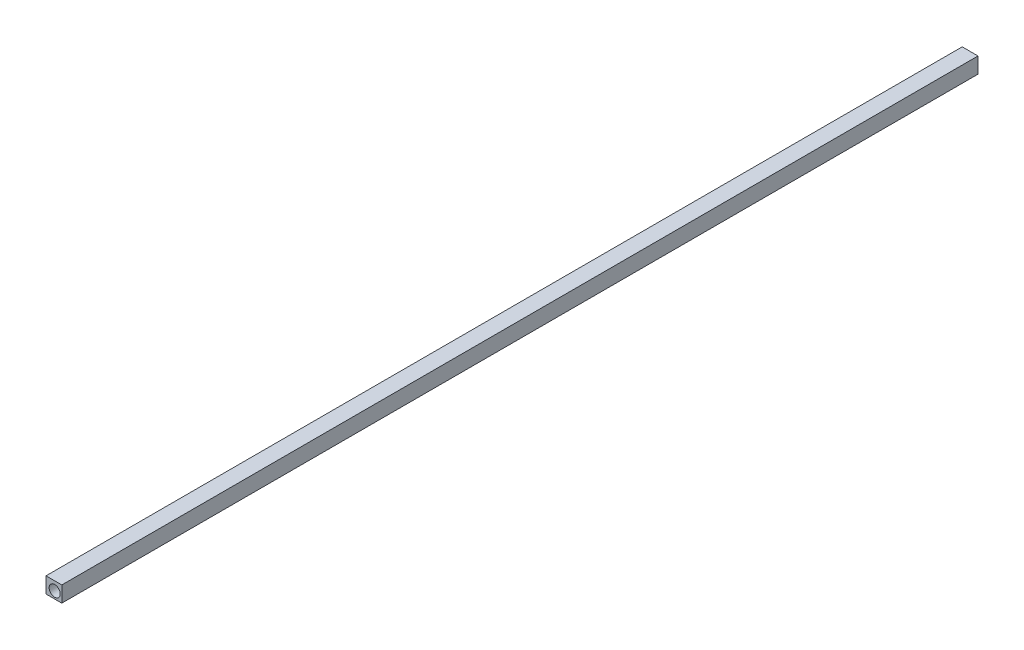
from build123d import *

# Parameters (mm, degrees)
SKETCH_1_W      = 10
SKETCH_1_H      = 10
SKETCH_1_R      = 3.5
EXTRUDE_1_DEPTH = 580


with BuildPart() as part:
    # 스케치1 → 보스-돌출1 (new body)
    with BuildSketch(Plane.XY):
        Rectangle(SKETCH_1_W, SKETCH_1_H)
        with Locations((0.5, -0.5)):
            Circle(SKETCH_1_R, mode=Mode.SUBTRACT)
    extrude(amount=EXTRUDE_1_DEPTH)


solid = part.part
